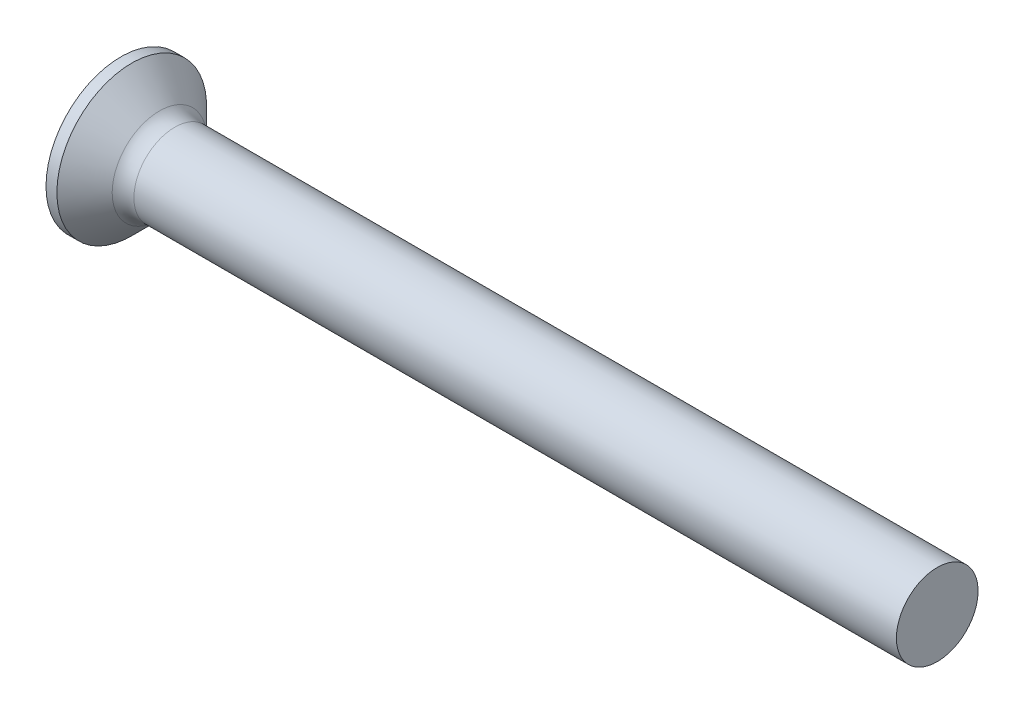
from build123d import *

# Parameters (mm, degrees)
FILLET1_R    = 0.8
RECPAT_COUNT = 2
RECPAT_ANGLE = 90


with BuildPart() as part:
    # BodySke → Base-Revolve (revolve)
    with BuildSketch(Plane.XY, mode=Mode.PRIVATE) as base_revolve_sk:
        Polygon((0, 0), (0, 2.75), (0.4, 2.75), (1.65, 1.5), (30, 1.5), (30, 0), align=None)
    revolve(base_revolve_sk.sketch.rotate(Axis((-6.35, 0, 0), (1, 0, 0)), 90), axis=Axis((-6.35, 0, 0), (1, 0, 0)))

    # Fillet1
    fillet1_edges = [part.edges().sort_by_distance(p)[0] for p in [
        (1.65, 0, -1.5),
    ]]
    fillet(fillet1_edges, radius=FILLET1_R)

    # Sketch3 → Recess section 0
    with BuildSketch(Plane.ZY):
        with BuildLine():
            Line((-0.37, 1.5), (0.37, 1.5))
            Line((0.37, 1.5), (0.37, -1.5))
            Line((0.37, -1.5), (-0.37, -1.5))
            Line((-0.37, -1.5), (-0.37, 1.5))
        make_face()
    # Sketch4 → Recess section 1
    with BuildSketch(Plane.ZY.offset(-2.01)):
        with BuildLine():
            Line((-0.37, 0.497851135), (0.37, 0.497851135))
            Line((0.37, 0.497851135), (0.37, -0.497851135))
            Line((0.37, -0.497851135), (-0.37, -0.497851135))
            Line((-0.37, -0.497851135), (-0.37, 0.497851135))
        make_face()
    recess = loft(mode=Mode.SUBTRACT)

    # RecPat: Recess ×2 about axis
    recpat_axis = Axis((0, 0, 0), (1, 0, 0))
    for i in range(1, RECPAT_COUNT):
        add(recess.rotate(recpat_axis, i * RECPAT_ANGLE / (RECPAT_COUNT - 1)), mode=Mode.SUBTRACT)

    # RecCorSke → RecessCore (revolve, cut)
    with BuildSketch(Plane.XY, mode=Mode.PRIVATE) as recesscore_sk:
        Polygon((0, 0), (0, 0.696552892), (2.01, 0.556), (2.190655351, 0), align=None)
    revolve(recesscore_sk.sketch.rotate(Axis((-3.175, 0, 0), (1, 0, 0)), 90), axis=Axis((-3.175, 0, 0), (1, 0, 0)), mode=Mode.SUBTRACT)


solid = part.part
